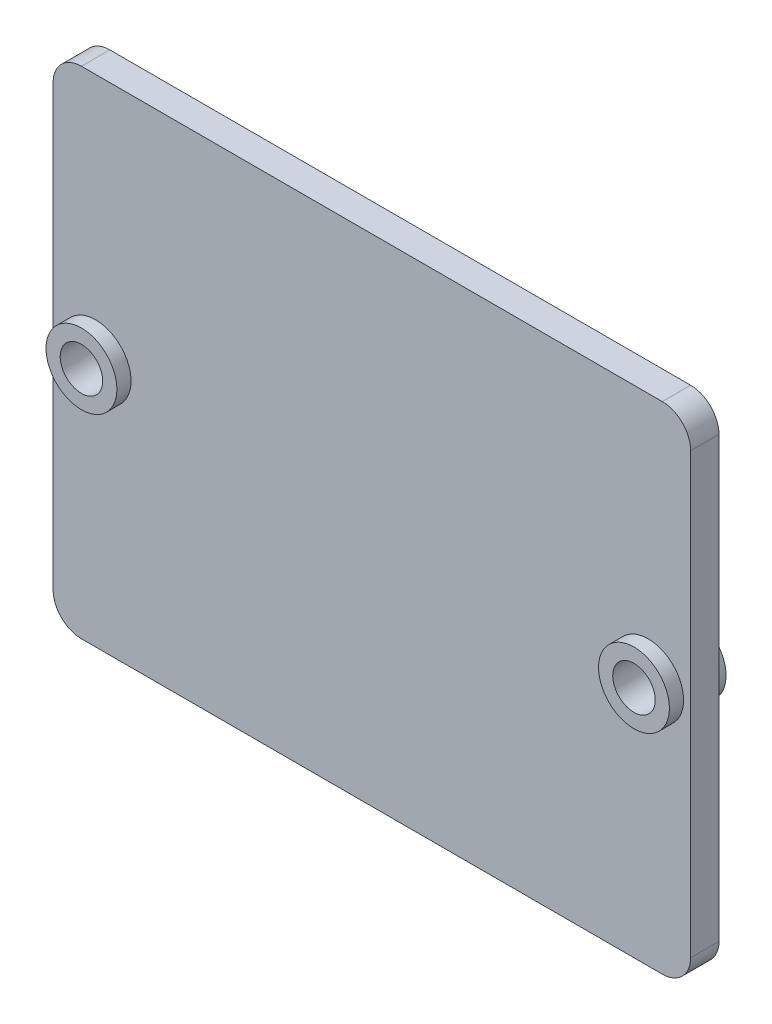
from build123d import *

# Parameters (mm, degrees)
SKETCH1_W                = 450
SKETCH1_H                = 350
BOSS_EXTRUDE1_DEPTH      = 20
SKETCH2_R                = 15
CUT_EXTRUDE1_DEPTH       = 25
BOSS_EXTRUDE2_DEPTH      = 10
BOSS_EXTRUDE2_DEPTH_BACK = 30
SKETCH3_R                = 25
SKETCH3_R_2              = 15
FILLET1_R                = 20


with BuildPart() as part:
    # Sketch1 → Boss-Extrude1 (new body)
    with BuildSketch(Plane.XY):
        with Locations((225, -175)):
            Rectangle(SKETCH1_W, SKETCH1_H)
    extrude(amount=BOSS_EXTRUDE1_DEPTH)

    # Sketch2 → Cut-Extrude1 (cut)
    with BuildSketch(Plane(origin=(0, 0, 0), x_dir=(-1, 0, 0), z_dir=(0, 0, -1))):
        with Locations((-420, -175)):
            Circle(SKETCH2_R)
        with Locations((-30, -175)):
            Circle(SKETCH2_R)
    extrude(amount=-CUT_EXTRUDE1_DEPTH, mode=Mode.SUBTRACT)

    # Sketch3 → Boss-Extrude2 (add, two sides: drawn at the far end of the back side and taken through both)
    # profile 1 of 2: a face of its own
    with BuildSketch(Plane(origin=(0, 0, 0), x_dir=(-1, 0, 0), z_dir=(0, 0, -1)).offset(-BOSS_EXTRUDE2_DEPTH_BACK)):
        with Locations((-420, -175)):
            Circle(SKETCH3_R)
        with Locations((-420, -175)):
            Circle(SKETCH3_R_2, mode=Mode.SUBTRACT)
    # profile 2 of 2: a face of its own
    with BuildSketch(Plane(origin=(0, 0, 0), x_dir=(-1, 0, 0), z_dir=(0, 0, -1)).offset(-BOSS_EXTRUDE2_DEPTH_BACK)):
        with Locations((-30, -175)):
            Circle(SKETCH3_R)
        with Locations((-30, -175)):
            Circle(SKETCH3_R_2, mode=Mode.SUBTRACT)
    extrude(amount=BOSS_EXTRUDE2_DEPTH + BOSS_EXTRUDE2_DEPTH_BACK)

    # Fillet1
    fillet1_edges = [part.edges().sort_by_distance(p)[0] for p in [
        (0, 0, 10),
        (450, 0, 10),
        (450, -350, 10),
        (0, -350, 10),
    ]]
    fillet(fillet1_edges, radius=FILLET1_R)


solid = part.part
